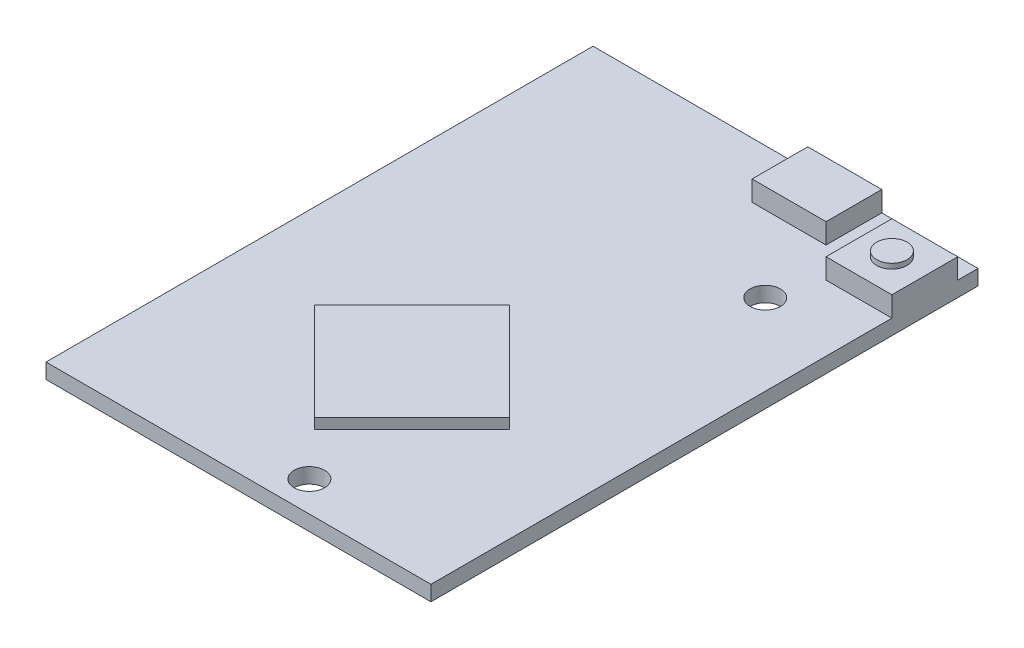
from build123d import *

# Parameters (mm, degrees)
SKETCH1_W               = 38
SKETCH1_H               = 54
PCB_DEPTH               = 1.5
ATMEGA_DEPTH            = 1
SKETCH3_W               = 7.3
SKETCH3_H               = 5.5
SKETCH3_W_2             = 6.5
SKETCH3_H_2             = 6.5
USB_AND_RST_DEPTH       = 2
SKETCH4_R               = 1.5
BUTTON_DEPTH            = 0.5
CUT_EXTRUDE1_DEPTH      = 34.109666262
CUT_EXTRUDE1_DEPTH_BACK = 34.109666262
SKETCH5_R               = 1.5


with BuildPart() as part:
    # Sketch1 → PCB (new body)
    with BuildSketch(Plane(origin=(0, 0, 0), x_dir=(1, 0, 0), z_dir=(0, 1, 0))):
        Rectangle(SKETCH1_W, SKETCH1_H)
    extrude(amount=PCB_DEPTH)

    # Sketch2 → ATMega (add)
    with BuildSketch(Plane(origin=(0, 1.5, 0), x_dir=(1, 0, 0), z_dir=(0, 1, 0))):
        Polygon((0, -0.266695552), (9.616652224, -9.883347776), (0, -19.5), (-9.616652224, -9.883347776), align=None)
    extrude(amount=ATMEGA_DEPTH)

    # Sketch3 → USB and RST (add)
    with BuildSketch(Plane(origin=(0, 1.5, 0), x_dir=(1, 0, 0), z_dir=(0, 1, 0))):
        with Locations((5.85, 24.25)):
            Rectangle(SKETCH3_W, SKETCH3_H)
        with Locations((15.75, 21.75)):
            Rectangle(SKETCH3_W_2, SKETCH3_H_2)
    extrude(amount=USB_AND_RST_DEPTH)

    # Sketch4 → Button (add)
    with BuildSketch(Plane(origin=(0, 3.5, 0), x_dir=(1, 0, 0), z_dir=(0, 1, 0))):
        with Locations(Location((15.75, 21.75, 0), (0, 0, 270))):
            Circle(SKETCH4_R)
    extrude(amount=BUTTON_DEPTH)

    # Sketch5 → Cut-Extrude1 (cut, two sides: drawn at the far end of the back side and taken through both)
    with BuildSketch(Plane(origin=(0, 1.5, 0), x_dir=(1, 0, 0), z_dir=(0, 1, 0)).offset(-CUT_EXTRUDE1_DEPTH_BACK)):
        with Locations(Location((11, 14, 0), (0, 0, 270))):
            Circle(SKETCH5_R)
        with Locations(Location((4, -24, 0), (0, 0, 270))):
            Circle(SKETCH5_R)
    extrude(amount=CUT_EXTRUDE1_DEPTH + CUT_EXTRUDE1_DEPTH_BACK, mode=Mode.SUBTRACT)


solid = part.part
